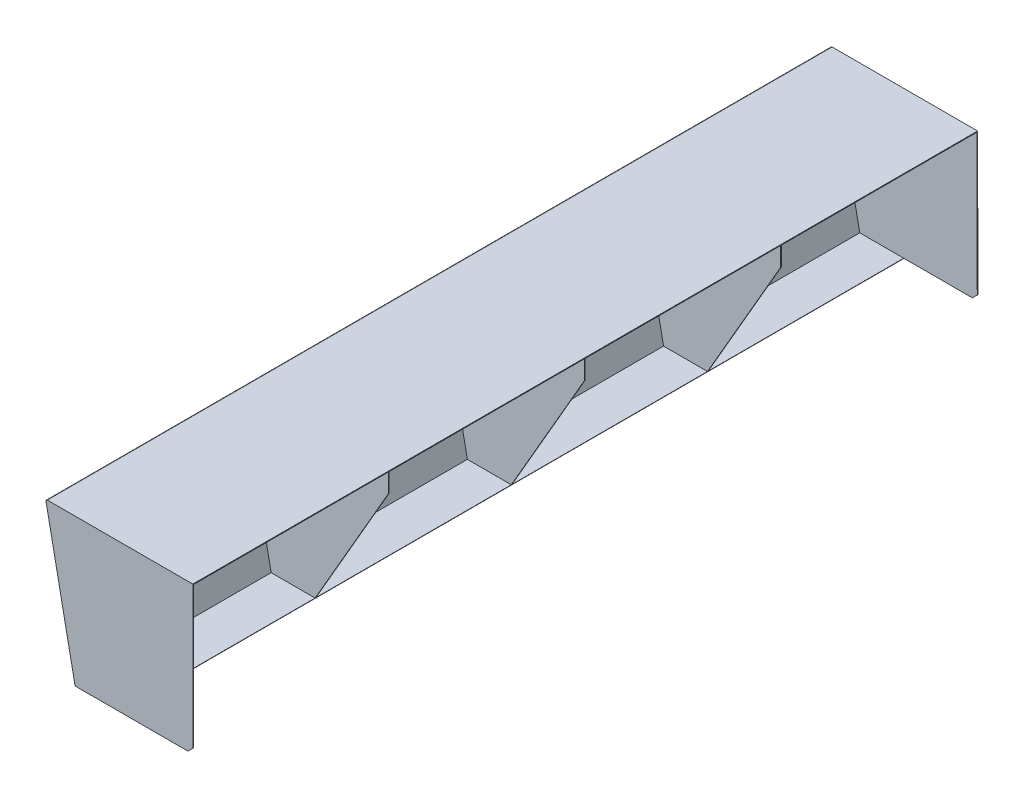
from build123d import *

# Parameters (mm, degrees)
SKETCH_1_W             = 300
SKETCH_1_H             = 300
EXTRUDE_1_DEPTH        = 1600
CUT_EXTRUDE_1_DEPTH    = 1656.294535725
CUT_EXTRUDE_4_DEPTH    = 1656.294535725
SHELL_2_T              = -1.5
EXTRUDE_2_DEPTH        = 1.5
PATTERN_LINEAR_1_COUNT = 3
PATTERN_LINEAR_1_PITCH = 400
EXTRUDE_3_DEPTH        = 1.5
EXTRUDE_4_DEPTH        = 1.5
FILLET_1_R             = 3


with BuildPart() as part:
    # 草图1 → 凸台-拉伸1 (new body)
    with BuildSketch(Plane.XY):
        with Locations((150, 150)):
            Rectangle(SKETCH_1_W, SKETCH_1_H)
    extrude(amount=EXTRUDE_1_DEPTH)

    # 草图7 → 切除-拉伸1 (cut, through all)
    with BuildSketch(Plane.XY.offset(1600)):
        Polygon((300, 260), (150, 0), (300, 0), align=None)
    extrude(amount=-CUT_EXTRUDE_1_DEPTH, mode=Mode.SUBTRACT)

    # 草图11 → 切除-拉伸4 (cut, through all)
    with BuildSketch(Plane.XY.offset(1600)):
        Polygon((0, 300), (0, 0), (60, 0), align=None)
    extrude(amount=-CUT_EXTRUDE_4_DEPTH, mode=Mode.SUBTRACT)

    # 抽壳2
    shell_2_openings = [part.faces().sort_by_distance(p)[0] for p in [
        (225, 130, 800),
        (300, 280, 800),
    ]]
    offset(amount=SHELL_2_T, openings=shell_2_openings, kind=Kind.INTERSECTION)

    # 草图13 → 凸台-拉伸2 (add)
    with BuildSketch(Plane.XY.offset(1200)):
        Polygon((1.829705854, 298.5), (61.229705854, 1.5), (150.865384615, 1.5), (300, 260), (300, 298.5), align=None)
    extrude_2 = extrude(amount=EXTRUDE_2_DEPTH)

    # 阵列(线性)1: 凸台-拉伸2 ×3
    with Locations(*[(0, 0, -i * PATTERN_LINEAR_1_PITCH) for i in range(1, PATTERN_LINEAR_1_COUNT)]):
        add(extrude_2)

    # 草图14 → 凸台-拉伸3 (add)
    with BuildSketch(Plane.XY.offset(1600)):
        Polygon((300, 260), (300, 10), (290, 0), (150, 0), align=None)
    extrude(amount=-EXTRUDE_3_DEPTH)

    # 草图15 → 凸台-拉伸4 (add)
    with BuildSketch(Plane(origin=(0, 0, 0), x_dir=(-1, 0, 0), z_dir=(0, 0, -1))):
        Polygon((-300, 260), (-150.865384615, 1.5), (-290.865384615, 1.5), (-300.831907642, 11.499943964), align=None)
    extrude(amount=-EXTRUDE_4_DEPTH)

    # 圆角1
    fillet_1_edges = [part.edges().sort_by_distance(p)[0] for p in [
        (0, 300, 800),
    ]]
    fillet(fillet_1_edges, radius=FILLET_1_R)


solid = part.part
